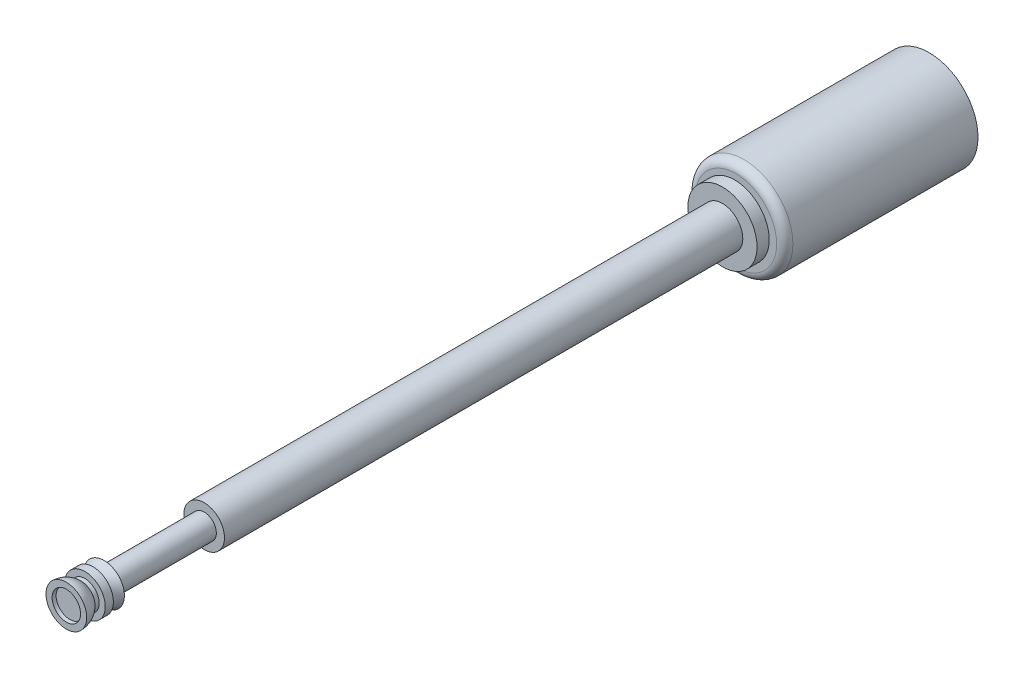
from build123d import *

# Parameters (mm, degrees)
SKETCH1_R           = 0.5
BOSS_EXTRUDE1_DEPTH = 15.5
SKETCH1_3_R         = 1.2
BOSS_EXTRUDE2_DEPTH = 4.75
FILLET1_R           = 0.2
SKETCH2_R           = 0.85
BOSS_EXTRUDE3_DEPTH = 0.3
SKETCH4_W           = 0.445498432
SKETCH4_H           = 0.1
SKETCH5_W           = 0.773123016
SKETCH5_H           = 2.46
SKETCH5_2_W         = 0.773123016
SKETCH5_2_H         = 2.46


with BuildPart() as part:
    # Sketch1 → Boss-Extrude1 (new body)
    with BuildSketch(Plane.XY):
        Circle(SKETCH1_R)
    extrude(amount=BOSS_EXTRUDE1_DEPTH)

    # Sketch1<3> → Boss-Extrude2 (add)
    with BuildSketch(Plane.XY):
        with Locations((0.031563249, 0)):
            Circle(SKETCH1_3_R)
    extrude(amount=-BOSS_EXTRUDE2_DEPTH)

    # Fillet1
    fillet1_edges = [part.edges().sort_by_distance(p)[0] for p in [
        (-1.168436751, 0, 0),
    ]]
    fillet(fillet1_edges, radius=FILLET1_R)

    # Sketch2 → Boss-Extrude3 (add)
    with BuildSketch(Plane.XY):
        Circle(SKETCH2_R)
    extrude(amount=BOSS_EXTRUDE3_DEPTH)

    # Sketch3 → Revolve2 (revolve)
    with BuildSketch(Plane(origin=(0, 0, 0), x_dir=(1, 0, 0), z_dir=(0, 1, 0))):
        with BuildLine():
            Line((0, -15.5), (0, -16.0775))
            ThreePointArc((0, -16.0775), (0.247487373, -16.180012627), (0.35, -16.4275))
            Line((0.35, -16.4275), (0.5, -16.4275))
            ThreePointArc((0.5, -16.4275), (0.460977223, -16.233850833), (0.35, -16.070428579))
            Line((0.35, -16.070428579), (0.35, -15.970428579))
            Line((0.35, -15.970428579), (0.5, -15.970428579))
            Line((0.5, -15.970428579), (0.5, -15.770428579))
            Line((0.5, -15.770428579), (0.4, -15.770428579))
            ThreePointArc((0.4, -15.770428579), (0.430084247, -15.627849774), (0.5, -15.5))
            Line((0.5, -15.5), (0, -15.5))
        make_face()
    revolve(axis=Axis((0, 0, 15.5), (0, 0, 1)))

    # Sketch4 → Revolve3 (revolve)
    with BuildSketch(Plane(origin=(0, 0, 0), x_dir=(1, 0, 0), z_dir=(0, 1, 0))):
        with Locations((-0.222202563, -16.29)):
            Rectangle(SKETCH4_W, SKETCH4_H)
    revolve(axis=Axis((0.000546653, 0, 16.34), (0, 0, -1)))

    # Sketch5 → Revolve4 (revolve)
    with BuildSketch(Plane(origin=(0, 0, 0), x_dir=(1, 0, 0), z_dir=(0, 1, 0))):
        with Locations((-0.686561508, -14.27)):
            Rectangle(SKETCH5_W, SKETCH5_H)
    revolve(axis=Axis((0, 0, 15.5), (0, 0, 1)))

    # Sketch5<2> → Cut-Revolve1 (revolve, cut)
    with BuildSketch(Plane(origin=(0, 0, 0), x_dir=(1, 0, 0), z_dir=(0, 1, 0))):
        with Locations((-0.686561508, -14.27)):
            Rectangle(SKETCH5_2_W, SKETCH5_2_H)
    revolve(axis=Axis((0, 0, 15.5), (0, 0, 1)), mode=Mode.SUBTRACT)


solid = part.part
